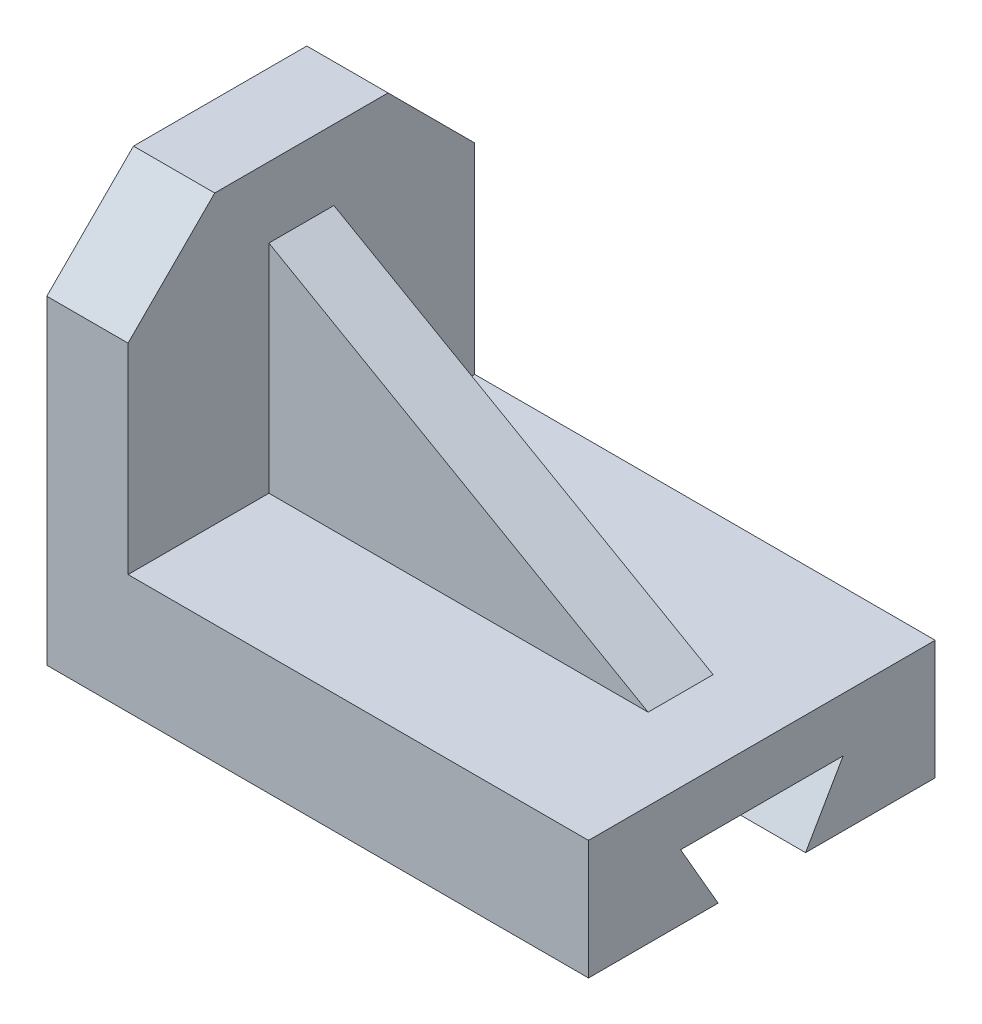
from build123d import *

# Parameters (mm, degrees)
SKETCH1_W           = 100
SKETCH1_H           = 64
BOSS_EXTRUDE1_DEPTH = 22
BOSS_EXTRUDE2_DEPTH = 15
CUT_EXTRUDE2_DEPTH  = 130.031004026
RIB1_REACH          = 97.65
SKETCH5_WALL_W      = 273.923387726
SKETCH5_WALL_H      = 12


with BuildPart() as part:
    # Sketch1 → Boss-Extrude1 (new body)
    with BuildSketch(Plane(origin=(0, 0, 0), x_dir=(1, 0, 0), z_dir=(0, 1, 0))):
        Rectangle(SKETCH1_W, SKETCH1_H)
    extrude(amount=BOSS_EXTRUDE1_DEPTH)

    # Sketch2 → Boss-Extrude2 (add)
    with BuildSketch(Plane.ZY.offset(50)):
        Polygon((-32, 22), (-32, 59), (-16, 75), (16, 75), (32, 59), (32, 22), align=None)
    extrude(amount=-BOSS_EXTRUDE2_DEPTH)

    # Sketch3 → Cut-Extrude2 (cut, through all)
    with BuildSketch(Plane(origin=(50, 0, 0), x_dir=(0, 0, -1), z_dir=(1, 0, 0))):
        Polygon((-8.07179677, 0), (-15, 12), (15, 12), (8.07179677, 0), align=None)
    extrude(amount=-CUT_EXTRUDE2_DEPTH, mode=Mode.SUBTRACT)

    # Sketch5 wall → Rib1 (add, up to next)
    with BuildSketch(Plane(origin=(0, 42, 0), x_dir=(0.868243142124, -0.496138938357, 0), z_dir=(0.496138938357, 0.868243142124, 0)), mode=Mode.PRIVATE) as rib1_sk1:
        Rectangle(SKETCH5_WALL_W, SKETCH5_WALL_H)
    rib1_tool1 = extrude(rib1_sk1.sketch, amount=-RIB1_REACH, mode=Mode.PRIVATE) - part.part
    add(rib1_tool1.solids().sort_by_distance((0, 42, 0))[0])


solid = part.part
